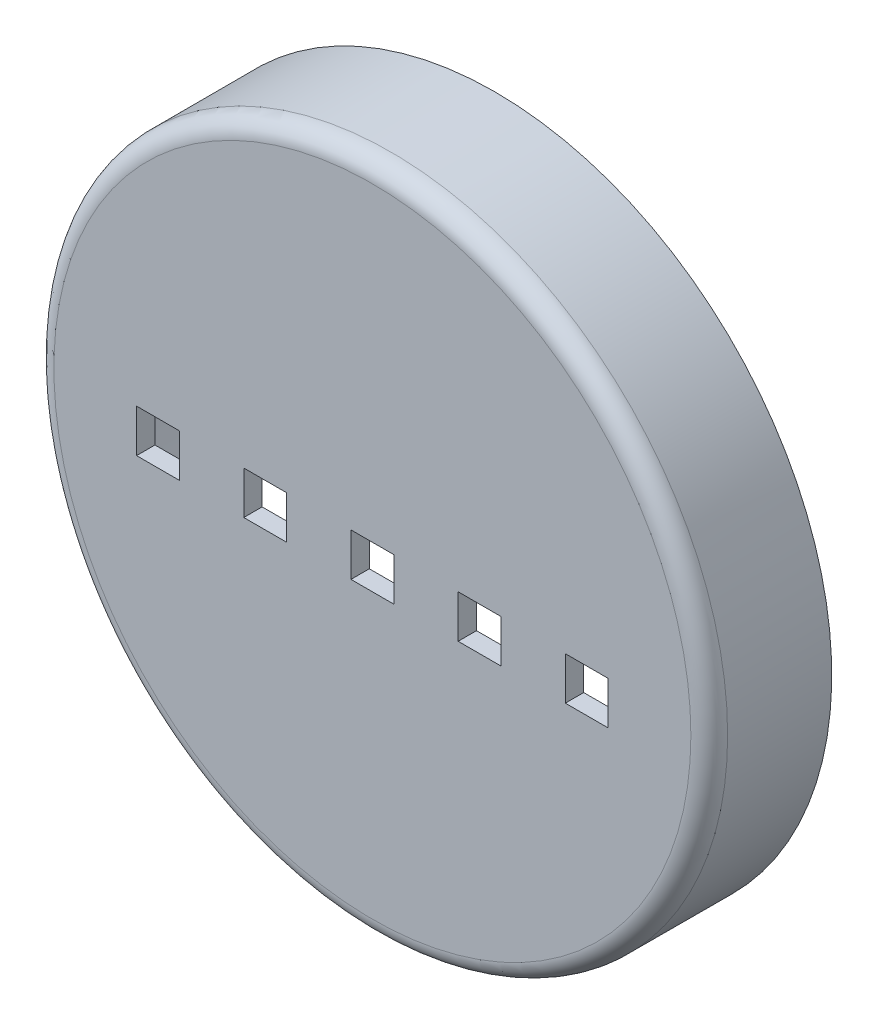
from build123d import *

# Parameters (mm, degrees)
SKETCH1_R                     = 55
BOSS_EXTRUDE2_DEPTH           = 20
SKETCH2_R                     = 51
CUT_EXTRUDE1_DEPTH            = 17
SKETCH10_R                    = 1.5
BOSS_EXTRUDE3_DEPTH           = 10
SKETCH10_3_W                  = 7
SKETCH10_3_H                  = 7
CUT_EXTRUDE4_DEPTH            = 10
FILLET1_R                     = 3
SKETCH11_R                    = 4
BOSS_EXTRUDE4_DEPTH           = 20
TAP_DRILL_FOR_4_40_TAP1_D     = 2.2606
TAP_DRILL_FOR_4_40_TAP1_DEPTH = 13.05
TAP_DRILL_FOR_4_40_TAP1_TIP   = 0.679152758
SKETCH14_R                    = 2.5
CUT_EXTRUDE5_DEPTH            = 50


with BuildPart() as part:
    # Sketch1 → Boss-Extrude2 (new body)
    with BuildSketch(Plane.XY):
        with Locations((328.389379834, 629.271631436)):
            Circle(SKETCH1_R)
    extrude(amount=BOSS_EXTRUDE2_DEPTH)

    # Sketch2 → Cut-Extrude1 (cut)
    with BuildSketch(Plane(origin=(0, 0, 0), x_dir=(-1, 0, 0), z_dir=(0, 0, -1))):
        with Locations((-328.628637891, 629.384320649)):
            Circle(SKETCH2_R)
    extrude(amount=-CUT_EXTRUDE1_DEPTH, mode=Mode.SUBTRACT)

    # Sketch10 → Boss-Extrude3 (add)
    with BuildSketch(Plane(origin=(0, 0, 17), x_dir=(-1, 0, 0), z_dir=(0, 0, -1))):
        with Locations((-374.389379834, 627.076422512)):
            Circle(SKETCH10_R)
        with Locations((-282.389379834, 627.076422512)):
            Circle(SKETCH10_R)
    extrude(amount=BOSS_EXTRUDE3_DEPTH)

    # Sketch10<3> → Cut-Extrude4 (cut)
    with BuildSketch(Plane(origin=(0, 0, 17), x_dir=(-1, 0, 0), z_dir=(0, 0, -1))):
        with Locations((-363.389379834, 627.076422512)):
            Rectangle(SKETCH10_3_W, SKETCH10_3_H)
        with Locations((-345.889379834, 627.076422512)):
            Rectangle(SKETCH10_3_W, SKETCH10_3_H)
        with Locations((-328.389379834, 627.076422512)):
            Rectangle(SKETCH10_3_W, SKETCH10_3_H)
        with Locations((-310.889379834, 627.076422512)):
            Rectangle(SKETCH10_3_W, SKETCH10_3_H)
        with Locations((-293.389379834, 627.076422512)):
            Rectangle(SKETCH10_3_W, SKETCH10_3_H)
    extrude(amount=-CUT_EXTRUDE4_DEPTH, mode=Mode.SUBTRACT)

    # Fillet1
    fillet1_edges = [part.edges().sort_by_distance(p)[0] for p in [
        (273.389379834, 629.271631436, 20),
    ]]
    fillet(fillet1_edges, radius=FILLET1_R)

    # Sketch11 → Boss-Extrude4 (add)
    with BuildSketch(Plane(origin=(0, 0, 17), x_dir=(-1, 0, 0), z_dir=(0, 0, -1))):
        with Locations((-306.628637891, 665.384320649)):
            Circle(SKETCH11_R)
        with Locations((-350.628637891, 665.384320649)):
            Circle(SKETCH11_R)
        with Locations((-350.628637891, 593.384320649)):
            Circle(SKETCH11_R)
        with Locations((-306.628637891, 593.384320649)):
            Circle(SKETCH11_R)
    extrude(amount=BOSS_EXTRUDE4_DEPTH)

    # Tap Drill for #4-40 Tap1
    with Locations(Plane(origin=(0, 0, -3), x_dir=(-1, 0, 0), z_dir=(0, 0, -1))):
        with Locations((-350.628637891, 665.384320649), (-306.628637891, 665.384320649), (-350.628637891, 593.384320649), (-306.628637891, 593.384320649)):
            Hole(TAP_DRILL_FOR_4_40_TAP1_D / 2, depth=TAP_DRILL_FOR_4_40_TAP1_DEPTH)
            with Locations((0, 0, -(TAP_DRILL_FOR_4_40_TAP1_DEPTH + TAP_DRILL_FOR_4_40_TAP1_TIP / 2))):  # 118° drill point
                Cone(0, TAP_DRILL_FOR_4_40_TAP1_D / 2, TAP_DRILL_FOR_4_40_TAP1_TIP, mode=Mode.SUBTRACT)

    # Sketch14 → Cut-Extrude5 (cut)
    with BuildSketch(Plane(origin=(0, 623.576422512, 0), x_dir=(1, 0, 0), z_dir=(0, 1, 0))):
        with Locations((330.379647502, 0)):
            Circle(SKETCH14_R)
    extrude(amount=-CUT_EXTRUDE5_DEPTH, mode=Mode.SUBTRACT)


solid = part.part
